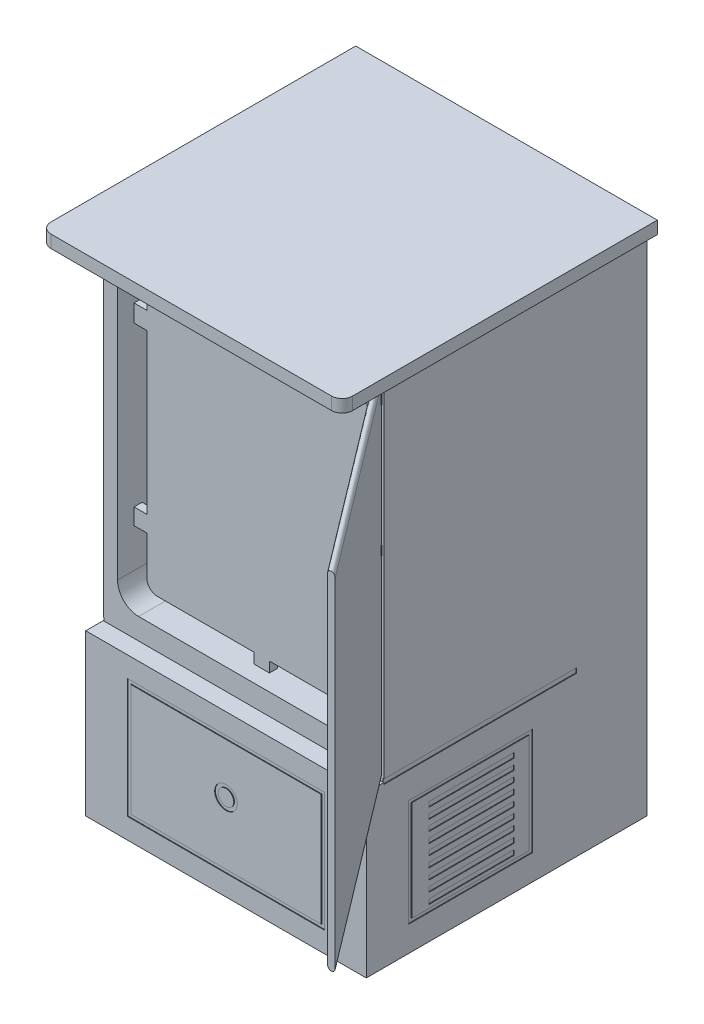
from build123d import *

# Parameters (mm, degrees)
CROQUIS1_W                = 800
CROQUIS1_H                = 600
SALIENTE_EXTRUIR1_DEPTH   = 1000
CORTAR_EXTRUIR1_DEPTH     = 567
CROQUIS3_W                = 800
CROQUIS3_H                = 35.957768847
SALIENTE_EXTRUIR2_DEPTH   = 99
CROQUIS4_W                = 699
CROQUIS4_H                = 35.957768847
SALIENTE_EXTRUIR3_DEPTH   = 30
CROQUIS5_W                = 699
CROQUIS5_H                = 35.957768847
SALIENTE_EXTRUIR4_DEPTH   = 30
REDONDEO1_R               = 30
CROQUIS6_W                = 800
CROQUIS6_H                = 486.805991466
SALIENTE_EXTRUIR5_DEPTH   = 600
CROQUIS8_W                = 800
CROQUIS8_H                = 993.182062535
CORTAR_EXTRUIR3_DEPTH     = 50
CROQUIS9_W                = 550
CROQUIS9_H                = 13.666207369
CORTAR_EXTRUIR4_DEPTH     = 2
CROQUIS10_W               = 550
CROQUIS10_H               = 13.666207369
CORTAR_EXTRUIR5_DEPTH     = 2
CROQUIS11_W               = 354.416964099
CROQUIS11_H               = 305.343845993
CROQUIS11_W_2             = 334.416964099
CROQUIS11_H_2             = 285.343845993
CORTAR_EXTRUIR6_DEPTH     = 2
CROQUIS12_W               = 354.416964099
CROQUIS12_H               = 305.343845993
CROQUIS12_W_2             = 334.416964099
CROQUIS12_H_2             = 285.343845993
CORTAR_EXTRUIR7_DEPTH     = 2
CROQUIS13_W               = 243.309624206
CROQUIS13_H               = 13.939613887
CORTAR_EXTRUIR8_DEPTH     = 2
MATRIZL1_COUNT            = 9
MATRIZL1_PITCH            = 30
SIMETR_A1_COPY_1_SKETCH_W = 243.309624206
SIMETR_A1_COPY_1_SKETCH_H = 13.939613887
SIMETR_A1_COPY_1_DEPTH    = 2
SIMETR_A1_COPY_2_SKETCH_W = 243.309624206
SIMETR_A1_COPY_2_SKETCH_H = 13.939613887
SIMETR_A1_COPY_2_DEPTH    = 2
SIMETR_A1_COPY_3_SKETCH_W = 243.309624206
SIMETR_A1_COPY_3_SKETCH_H = 13.939613887
SIMETR_A1_COPY_3_DEPTH    = 2
SIMETR_A1_COPY_4_SKETCH_W = 243.309624206
SIMETR_A1_COPY_4_SKETCH_H = 13.939613887
SIMETR_A1_COPY_4_DEPTH    = 2
SIMETR_A1_COPY_5_SKETCH_W = 243.309624206
SIMETR_A1_COPY_5_SKETCH_H = 13.939613887
SIMETR_A1_COPY_5_DEPTH    = 2
SIMETR_A1_COPY_6_SKETCH_W = 243.309624206
SIMETR_A1_COPY_6_SKETCH_H = 13.939613887
SIMETR_A1_COPY_6_DEPTH    = 2
SIMETR_A1_COPY_7_SKETCH_W = 243.309624206
SIMETR_A1_COPY_7_SKETCH_H = 13.939613887
SIMETR_A1_COPY_7_DEPTH    = 2
SIMETR_A1_COPY_8_SKETCH_W = 243.309624206
SIMETR_A1_COPY_8_SKETCH_H = 13.939613887
SIMETR_A1_COPY_8_DEPTH    = 2
CROQUIS14_W               = 563.20495413
CROQUIS14_H               = 340.598481742
CROQUIS14_W_2             = 543.20495413
CROQUIS14_H_2             = 320.598481742
CORTAR_EXTRUIR9_DEPTH     = 2
CROQUIS15_R               = 32.209771252
CROQUIS15_R_2             = 22.209771252
CORTAR_EXTRUIR10_DEPTH    = 2
CROQUIS18_W               = 34.691743086
CROQUIS18_H               = 30.529625404
CROQUIS18_W_2             = 44.468602639
CROQUIS18_H_2             = 33.523883017
CROQUIS18_H_3             = 26.695345902
SALIENTE_EXTRUIR6_DEPTH   = 22
REDONDEO2_R               = 19
CORTAR_EXTRUIR11_DEPTH    = 3
CROQUIS20_W               = 44.562430694
CROQUIS20_H               = 46.694432352
CROQUIS20_H_2             = 35.984257535
CROQUIS20_W_2             = 73.041407783
CROQUIS20_H_3             = 49.656905024
CROQUIS20_H_4             = 46.208188546
CROQUIS20_W_3             = 57.507633586
CROQUIS20_H_5             = 75.965991012
CROQUIS20_W_4             = 44.486501302
CROQUIS20_H_6             = 58.796125296
SALIENTE_EXTRUIR7_DEPTH   = 23
CROQUIS21_W               = 535.403782416
CROQUIS21_H               = 17.835231245
SALIENTE_EXTRUIR8_DEPTH   = 218
SALIENTE_EXTRUIR9_DEPTH   = 200


with BuildPart() as part:
    # Croquis1 → Saliente-Extruir1 (new body)
    with BuildSketch(Plane(origin=(0, 0, 0), x_dir=(1, 0, 0), z_dir=(0, 1, 0))):
        Rectangle(CROQUIS1_W, CROQUIS1_H)
    extrude(amount=SALIENTE_EXTRUIR1_DEPTH)

    # Croquis2 → Cortar-Extruir1 (cut)
    with BuildSketch(Plane.XY.offset(300)):
        with BuildLine():
            Line((-299.259727569, 934.483814363), (294.27207392, 934.483814363))
            ThreePointArc((294.27207392, 934.483814363), (336.698480791, 916.910221234), (354.27207392, 874.483814363))
            Line((354.27207392, 874.483814363), (354.27207392, 91.459739531))
            ThreePointArc((354.27207392, 91.459739531), (336.698480791, 49.03333266), (294.27207392, 31.459739531))
            Line((294.27207392, 31.459739531), (-299.259727569, 31.459739531))
            ThreePointArc((-299.259727569, 31.459739531), (-341.68613444, 49.03333266), (-359.259727569, 91.459739531))
            Line((-359.259727569, 91.459739531), (-359.259727569, 874.483814363))
            ThreePointArc((-359.259727569, 874.483814363), (-341.68613444, 916.910221234), (-299.259727569, 934.483814363))
        make_face()
    extrude(amount=-CORTAR_EXTRUIR1_DEPTH, mode=Mode.SUBTRACT)

    # Croquis3 → Saliente-Extruir2 (add)
    with BuildSketch(Plane.XY.offset(300)):
        with Locations((0, 982.021115577)):
            Rectangle(CROQUIS3_W, CROQUIS3_H)
    extrude(amount=SALIENTE_EXTRUIR2_DEPTH)

    # Croquis4 → Saliente-Extruir3 (add)
    with BuildSketch(Plane(origin=(400, 0, 0), x_dir=(0, 0, -1), z_dir=(1, 0, 0))):
        with Locations((-49.5, 982.021115577)):
            Rectangle(CROQUIS4_W, CROQUIS4_H)
    extrude(amount=SALIENTE_EXTRUIR3_DEPTH)

    # Croquis5 → Saliente-Extruir4 (add)
    with BuildSketch(Plane.ZY.offset(400)):
        with Locations((49.5, 982.021115577)):
            Rectangle(CROQUIS5_W, CROQUIS5_H)
    extrude(amount=SALIENTE_EXTRUIR4_DEPTH)

    # Redondeo1
    redondeo1_edges = [part.edges().sort_by_distance(p)[0] for p in [
        (430, 982.021115577, 399),
        (-430, 982.021115577, 399),
    ]]
    fillet(redondeo1_edges, radius=REDONDEO1_R)

    # Croquis6 → Saliente-Extruir5 (add)
    with BuildSketch(Plane(origin=(0, 0, -300), x_dir=(-1, 0, 0), z_dir=(0, 0, -1))):
        with Locations((0, -243.402995733)):
            Rectangle(CROQUIS6_W, CROQUIS6_H)
    extrude(amount=-SALIENTE_EXTRUIR5_DEPTH)

    # Croquis8 → Cortar-Extruir3 (cut)
    with BuildSketch(Plane.XY.offset(300)):
        with Locations((0, 467.451199886)):
            Rectangle(CROQUIS8_W, CROQUIS8_H)
    extrude(amount=-CORTAR_EXTRUIR3_DEPTH, mode=Mode.SUBTRACT)

    # Croquis9 → Cortar-Extruir4 (cut)
    with BuildSketch(Plane.ZY.offset(400)):
        with Locations((-25, -27.151049572)):
            Rectangle(CROQUIS9_W, CROQUIS9_H)
    extrude(amount=-CORTAR_EXTRUIR4_DEPTH, mode=Mode.SUBTRACT)

    # Croquis10 → Cortar-Extruir5 (cut)
    with BuildSketch(Plane(origin=(400, 0, 0), x_dir=(0, 0, -1), z_dir=(1, 0, 0))):
        with Locations((25, -27.151049572)):
            Rectangle(CROQUIS10_W, CROQUIS10_H)
    extrude(amount=-CORTAR_EXTRUIR5_DEPTH, mode=Mode.SUBTRACT)

    # Croquis11 → Cortar-Extruir6 (cut)
    with BuildSketch(Plane.ZY.offset(400)):
        with Locations((2.727596994, -261.728327175)):
            Rectangle(CROQUIS11_W, CROQUIS11_H)
        with Locations((2.727596994, -261.728327175)):
            Rectangle(CROQUIS11_W_2, CROQUIS11_H_2, mode=Mode.SUBTRACT)
    extrude(amount=-CORTAR_EXTRUIR6_DEPTH, mode=Mode.SUBTRACT)

    # Croquis12 → Cortar-Extruir7 (cut)
    with BuildSketch(Plane(origin=(400, 0, 0), x_dir=(0, 0, -1), z_dir=(1, 0, 0))):
        with Locations((-2.727596994, -261.728327175)):
            Rectangle(CROQUIS12_W, CROQUIS12_H)
        with Locations((-2.727596994, -261.728327175)):
            Rectangle(CROQUIS12_W_2, CROQUIS12_H_2, mode=Mode.SUBTRACT)
    extrude(amount=-CORTAR_EXTRUIR7_DEPTH, mode=Mode.SUBTRACT)

    # Croquis13 → Cortar-Extruir8 (cut)
    with BuildSketch(Plane.ZY.offset(400)):
        with Locations((-0.370526782, -147.593668647)):
            Rectangle(CROQUIS13_W, CROQUIS13_H)
    cortar_extruir8 = extrude(amount=-CORTAR_EXTRUIR8_DEPTH, mode=Mode.SUBTRACT)

    # MatrizL1: Cortar-Extruir8 ×9
    with Locations(*[(0, -i * MATRIZL1_PITCH, 0) for i in range(1, MATRIZL1_COUNT)]):
        add(cortar_extruir8, mode=Mode.SUBTRACT)

    # Simetría1: Cortar-Extruir8 across plane
    add(cortar_extruir8.mirror(Plane(origin=(0, 0, 0), x_dir=(0, 0, 1), z_dir=(1, 0, 0))), mode=Mode.SUBTRACT)

    # Simetría1 copy 1 sketch → Simetría1 copy 1 (cut)
    with BuildSketch(Plane(origin=(400, -30, 0), x_dir=(0, 0, 1), z_dir=(1, 0, 0))):
        with Locations((-0.370526782, 147.593668647)):
            Rectangle(SIMETR_A1_COPY_1_SKETCH_W, SIMETR_A1_COPY_1_SKETCH_H)
    extrude(amount=-SIMETR_A1_COPY_1_DEPTH, mode=Mode.SUBTRACT)

    # Simetría1 copy 2 sketch → Simetría1 copy 2 (cut)
    with BuildSketch(Plane(origin=(400, -60, 0), x_dir=(0, 0, 1), z_dir=(1, 0, 0))):
        with Locations((-0.370526782, 147.593668647)):
            Rectangle(SIMETR_A1_COPY_2_SKETCH_W, SIMETR_A1_COPY_2_SKETCH_H)
    extrude(amount=-SIMETR_A1_COPY_2_DEPTH, mode=Mode.SUBTRACT)

    # Simetría1 copy 3 sketch → Simetría1 copy 3 (cut)
    with BuildSketch(Plane(origin=(400, -90, 0), x_dir=(0, 0, 1), z_dir=(1, 0, 0))):
        with Locations((-0.370526782, 147.593668647)):
            Rectangle(SIMETR_A1_COPY_3_SKETCH_W, SIMETR_A1_COPY_3_SKETCH_H)
    extrude(amount=-SIMETR_A1_COPY_3_DEPTH, mode=Mode.SUBTRACT)

    # Simetría1 copy 4 sketch → Simetría1 copy 4 (cut)
    with BuildSketch(Plane(origin=(400, -120, 0), x_dir=(0, 0, 1), z_dir=(1, 0, 0))):
        with Locations((-0.370526782, 147.593668647)):
            Rectangle(SIMETR_A1_COPY_4_SKETCH_W, SIMETR_A1_COPY_4_SKETCH_H)
    extrude(amount=-SIMETR_A1_COPY_4_DEPTH, mode=Mode.SUBTRACT)

    # Simetría1 copy 5 sketch → Simetría1 copy 5 (cut)
    with BuildSketch(Plane(origin=(400, -150, 0), x_dir=(0, 0, 1), z_dir=(1, 0, 0))):
        with Locations((-0.370526782, 147.593668647)):
            Rectangle(SIMETR_A1_COPY_5_SKETCH_W, SIMETR_A1_COPY_5_SKETCH_H)
    extrude(amount=-SIMETR_A1_COPY_5_DEPTH, mode=Mode.SUBTRACT)

    # Simetría1 copy 6 sketch → Simetría1 copy 6 (cut)
    with BuildSketch(Plane(origin=(400, -180, 0), x_dir=(0, 0, 1), z_dir=(1, 0, 0))):
        with Locations((-0.370526782, 147.593668647)):
            Rectangle(SIMETR_A1_COPY_6_SKETCH_W, SIMETR_A1_COPY_6_SKETCH_H)
    extrude(amount=-SIMETR_A1_COPY_6_DEPTH, mode=Mode.SUBTRACT)

    # Simetría1 copy 7 sketch → Simetría1 copy 7 (cut)
    with BuildSketch(Plane(origin=(400, -210, 0), x_dir=(0, 0, 1), z_dir=(1, 0, 0))):
        with Locations((-0.370526782, 147.593668647)):
            Rectangle(SIMETR_A1_COPY_7_SKETCH_W, SIMETR_A1_COPY_7_SKETCH_H)
    extrude(amount=-SIMETR_A1_COPY_7_DEPTH, mode=Mode.SUBTRACT)

    # Simetría1 copy 8 sketch → Simetría1 copy 8 (cut)
    with BuildSketch(Plane(origin=(400, -240, 0), x_dir=(0, 0, 1), z_dir=(1, 0, 0))):
        with Locations((-0.370526782, 147.593668647)):
            Rectangle(SIMETR_A1_COPY_8_SKETCH_W, SIMETR_A1_COPY_8_SKETCH_H)
    extrude(amount=-SIMETR_A1_COPY_8_DEPTH, mode=Mode.SUBTRACT)

    # Croquis14 → Cortar-Extruir9 (cut)
    with BuildSketch(Plane.XY.offset(300)):
        with Locations((0, -257.972911424)):
            Rectangle(CROQUIS14_W, CROQUIS14_H)
        with Locations((0, -257.972911424)):
            Rectangle(CROQUIS14_W_2, CROQUIS14_H_2, mode=Mode.SUBTRACT)
    extrude(amount=-CORTAR_EXTRUIR9_DEPTH, mode=Mode.SUBTRACT)

    # Croquis15 → Cortar-Extruir10 (cut)
    with BuildSketch(Plane.XY.offset(300)):
        with Locations((0, -241.078346398)):
            Circle(CROQUIS15_R)
        with Locations((0, -241.078346398)):
            Circle(CROQUIS15_R_2, mode=Mode.SUBTRACT)
    extrude(amount=-CORTAR_EXTRUIR10_DEPTH, mode=Mode.SUBTRACT)

    # Barrer1: sweep along a curve in space
    with BuildLine() as barrer1_path:
        Line((381.946438311, 467.235507916, 250), (793.481110183, 467.318527679, 793.146863733))
    # Croquis17 → Barrer1 (sweep)
    with BuildSketch(Plane.XY.offset(250)):
        with BuildLine():
            Line((392.862198364, 950.092677746), (392.862198364, -15.621661914))
            ThreePointArc((392.862198364, -15.621661914), (381.946438311, -26.537421967), (371.030678258, -15.621661914))
            Line((371.030678258, -15.621661914), (371.030678258, 950.092677746))
            ThreePointArc((371.030678258, 950.092677746), (381.946438311, 961.0084378), (392.862198364, 950.092677746))
        make_face()
    sweep(path=barrer1_path.line)

    # Croquis18 → Saliente-Extruir6 (add)
    with BuildSketch(Plane.XY.offset(250)):
        with Locations((377.357040996, 915.688026457)):
            Rectangle(CROQUIS18_W, CROQUIS18_H)
        with Locations((368.316814459, 6.739425021)):
            Rectangle(CROQUIS18_W_2, CROQUIS18_H_2)
        with Locations((377.357040996, 540.796431256)):
            Rectangle(CROQUIS18_W, CROQUIS18_H_3)
    extrude(amount=SALIENTE_EXTRUIR6_DEPTH)

    # Redondeo2
    redondeo2_edges = [part.edges().sort_by_distance(p)[0] for p in [
        (360.011169453, 915.688026457, 272),
        (346.082513139, 6.739425021, 272),
        (360.011169453, 540.796431256, 272),
    ]]
    fillet(redondeo2_edges, radius=REDONDEO2_R)

    # Croquis19 → Cortar-Extruir11 (cut)
    with BuildSketch(Plane(origin=(115.374267512, 0, -87.417445434), x_dir=(0.603913418650581, 0, 0.7970499248941487), z_dir=(-0.7970499248941487, 0, 0.603913418650581))):
        with BuildLine():
            Line((515.246456877, 6.925848235), (1050.984048336, 6.925848235))
            ThreePointArc((1050.984048336, 6.925848235), (1072.197251772, 15.712644799), (1080.984048336, 36.925848235))
            Line((1080.984048336, 36.925848235), (1080.984048336, 894.163276302))
            ThreePointArc((1080.984048336, 894.163276302), (1072.197251772, 915.376479738), (1050.984048336, 924.163276302))
            Line((1050.984048336, 924.163276302), (515.246456877, 924.163276302))
            ThreePointArc((515.246456877, 924.163276302), (494.033253441, 915.376479738), (485.246456877, 894.163276302))
            Line((485.246456877, 894.163276302), (485.246456877, 36.925848235))
            ThreePointArc((485.246456877, 36.925848235), (494.033253441, 15.712644799), (515.246456877, 6.925848235))
        make_face()
        with BuildLine():
            Line((495.246456877, 46.925848235), (495.246456877, 884.163276302))
            ThreePointArc((495.246456877, 884.163276302), (504.033253441, 905.376479738), (525.246456877, 914.163276302))
            Line((525.246456877, 914.163276302), (1040.984048336, 914.163276302))
            ThreePointArc((1040.984048336, 914.163276302), (1062.197251772, 905.376479738), (1070.984048336, 884.163276302))
            Line((1070.984048336, 884.163276302), (1070.984048336, 46.925848235))
            ThreePointArc((1070.984048336, 46.925848235), (1062.197251772, 25.712644799), (1040.984048336, 16.925848235))
            Line((1040.984048336, 16.925848235), (525.246456877, 16.925848235))
            ThreePointArc((525.246456877, 16.925848235), (504.033253441, 25.712644799), (495.246456877, 46.925848235))
        make_face(mode=Mode.SUBTRACT)
    extrude(amount=-CORTAR_EXTRUIR11_DEPTH, mode=Mode.SUBTRACT)

    # Croquis20 → Saliente-Extruir7 (add)
    with BuildSketch(Plane.XY.offset(180)):
        with BuildLine():
            Line((-292.739023677, 60.857802179), (301.990858573, 60.857802179))
            ThreePointArc((301.990858573, 60.857802179), (323.204062009, 69.644598744), (331.990858573, 90.857802179))
            Line((331.990858573, 90.857802179), (331.990858573, 866.500818857))
            ThreePointArc((331.990858573, 866.500818857), (323.204062009, 887.714022293), (301.990858573, 896.500818857))
            Line((301.990858573, 896.500818857), (-292.739023677, 896.500818857))
            ThreePointArc((-292.739023677, 896.500818857), (-313.952227113, 887.714022293), (-322.739023677, 866.500818857))
            Line((-322.739023677, 866.500818857), (-322.739023677, 90.857802179))
            ThreePointArc((-322.739023677, 90.857802179), (-313.952227113, 69.644598744), (-292.739023677, 60.857802179))
        make_face()
        with Locations((331.990858573, 727.730285012)):
            Rectangle(CROQUIS20_W, CROQUIS20_H)
        with Locations((331.990858573, 205.021757931)):
            Rectangle(CROQUIS20_W, CROQUIS20_H_2)
        with Locations((-322.739023677, 727.484970932)):
            Rectangle(CROQUIS20_W_2, CROQUIS20_H_3)
        with Locations((-322.739023677, 225.379990245)):
            Rectangle(CROQUIS20_W_2, CROQUIS20_H_4)
        with Locations((4.625917448, 896.500818857)):
            Rectangle(CROQUIS20_W_3, CROQUIS20_H_5)
        with Locations((4.625917448, 60.857802179)):
            Rectangle(CROQUIS20_W_4, CROQUIS20_H_6)
    extrude(amount=SALIENTE_EXTRUIR7_DEPTH)

    # Croquis21 → Saliente-Extruir8 (add)
    with BuildSketch(Plane.XY.offset(-267)):
        with Locations((0, 354.065407038)):
            Rectangle(CROQUIS21_W, CROQUIS21_H)
    extrude(amount=SALIENTE_EXTRUIR8_DEPTH)

    # Croquis22 → Saliente-Extruir9 (add)
    with BuildSketch(Plane(origin=(0, 0, -300), x_dir=(-1, 0, 0), z_dir=(0, 0, -1))):
        Polygon((-430, 964.042231153), (-430, 1000), (430, 1000), (430, 964.042231153), (400, 964.042231153), (400, -486.805991466), (-400, -486.805991466), (-400, 964.042231153), align=None)
    extrude(amount=SALIENTE_EXTRUIR9_DEPTH)


solid = part.part
